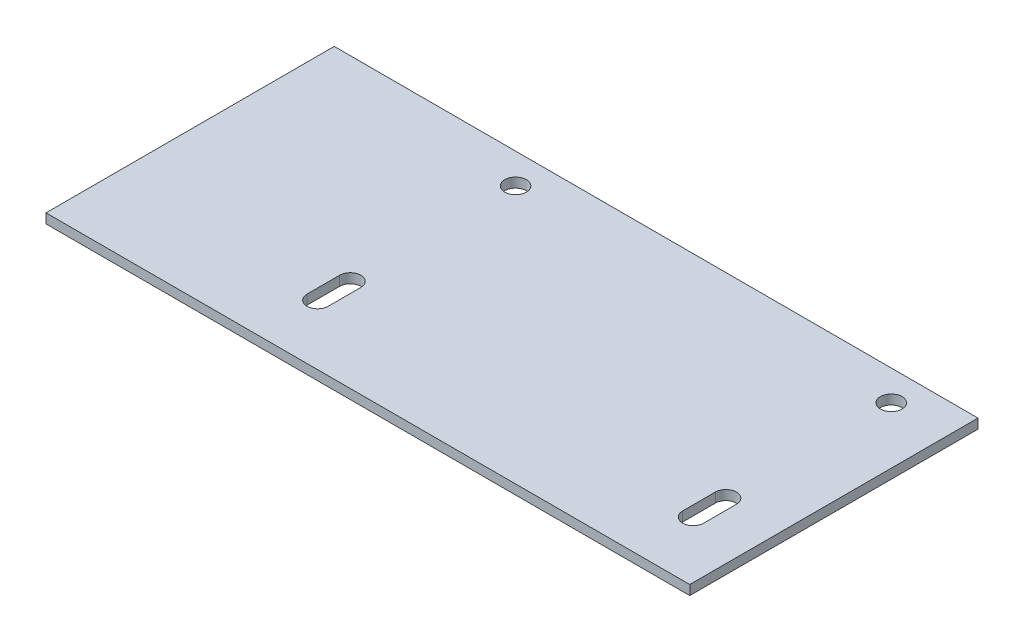
from build123d import *

# Parameters (mm, degrees)
SKETCH1_W           = 335
SKETCH1_H           = 150
BOSS_EXTRUDE1_DEPTH = 5
SKETCH2_R           = 5.625
CUT_EXTRUDE1_DEPTH  = 10


with BuildPart() as part:
    # Sketch1 → Boss-Extrude1 (new body)
    with BuildSketch(Plane(origin=(0, 0, 0), x_dir=(1, 0, 0), z_dir=(0, 1, 0))):
        Rectangle(SKETCH1_W, SKETCH1_H)
    extrude(amount=BOSS_EXTRUDE1_DEPTH)

    # Sketch2 → Cut-Extrude1 (cut)
    with BuildSketch(Plane(origin=(0, 5, 0), x_dir=(1, 0, 0), z_dir=(0, 1, 0))):
        with Locations(Location((138.025, 59.315, 0), (0, 0, 270))):
            Circle(SKETCH2_R)
        with Locations(Location((-57.465, 59.315, 0), (0, 0, 270))):
            Circle(SKETCH2_R)
        with BuildLine():
            Line((143.49, -26.69), (143.49, -43.69))
            ThreePointArc((143.49, -43.69), (137.99, -49.19), (132.49, -43.69))
            Line((132.49, -43.69), (132.49, -26.69))
            ThreePointArc((132.49, -26.69), (137.99, -21.19), (143.49, -26.69))
        make_face()
        with BuildLine():
            Line((-51.96, -26.69), (-51.96, -43.69))
            ThreePointArc((-51.96, -43.69), (-57.46, -49.19), (-62.96, -43.69))
            Line((-62.96, -43.69), (-62.96, -26.69))
            ThreePointArc((-62.96, -26.69), (-57.46, -21.19), (-51.96, -26.69))
        make_face()
    extrude(amount=-CUT_EXTRUDE1_DEPTH, mode=Mode.SUBTRACT)


solid = part.part
